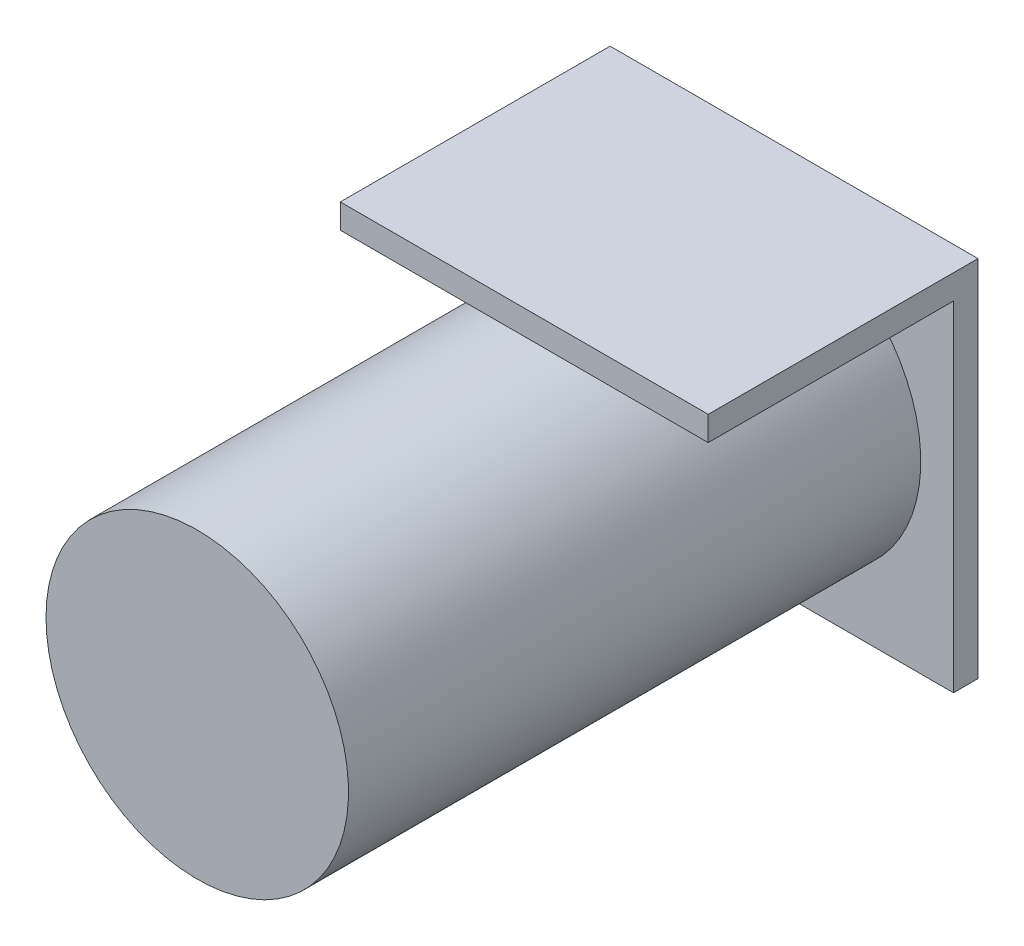
from build123d import *

# Parameters (mm, degrees)
SK_BRACKET_FACE_W  = 3
SK_BRACKET_FACE_H  = 44.5
BRACKET_FACE_DEPTH = 22.5
SK_BRACKET_TOP_W   = 33
SK_BRACKET_TOP_H   = 3
BRACKET_TOP_DEPTH  = 22.5


with BuildPart() as part:
    # SK_Gearmotor → Gearmotor (revolve)
    with BuildSketch(Plane(origin=(0, 0, 0), x_dir=(1, 0, 0), z_dir=(0, 1, 0)), mode=Mode.PRIVATE) as gearmotor_sk:
        Polygon((0, 18), (3, 18), (3, 0), (18.5, 0), (18.5, -70), (0, -70), align=None)
    revolve(gearmotor_sk.sketch.rotate(Axis((0, 0, -23), (0, 0, 1)), 180), axis=Axis((0, 0, -23), (0, 0, 1)))

    # SK_Bracket_Face → Bracket_Face (add, symmetric)
    with BuildSketch(Plane(origin=(0, 0, 0), x_dir=(0, 0, -1), z_dir=(1, 0, 0))):
        with Locations((1.5, -0.25)):
            Rectangle(SK_BRACKET_FACE_W, SK_BRACKET_FACE_H)
    extrude(amount=BRACKET_FACE_DEPTH, both=True)

    # SK_Bracket_Top → Bracket_Top (add, symmetric)
    with BuildSketch(Plane(origin=(0, 0, 0), x_dir=(0, 0, -1), z_dir=(1, 0, 0))):
        with Locations((-13.5, 20.5)):
            Rectangle(SK_BRACKET_TOP_W, SK_BRACKET_TOP_H)
    extrude(amount=BRACKET_TOP_DEPTH, both=True)


solid = part.part
